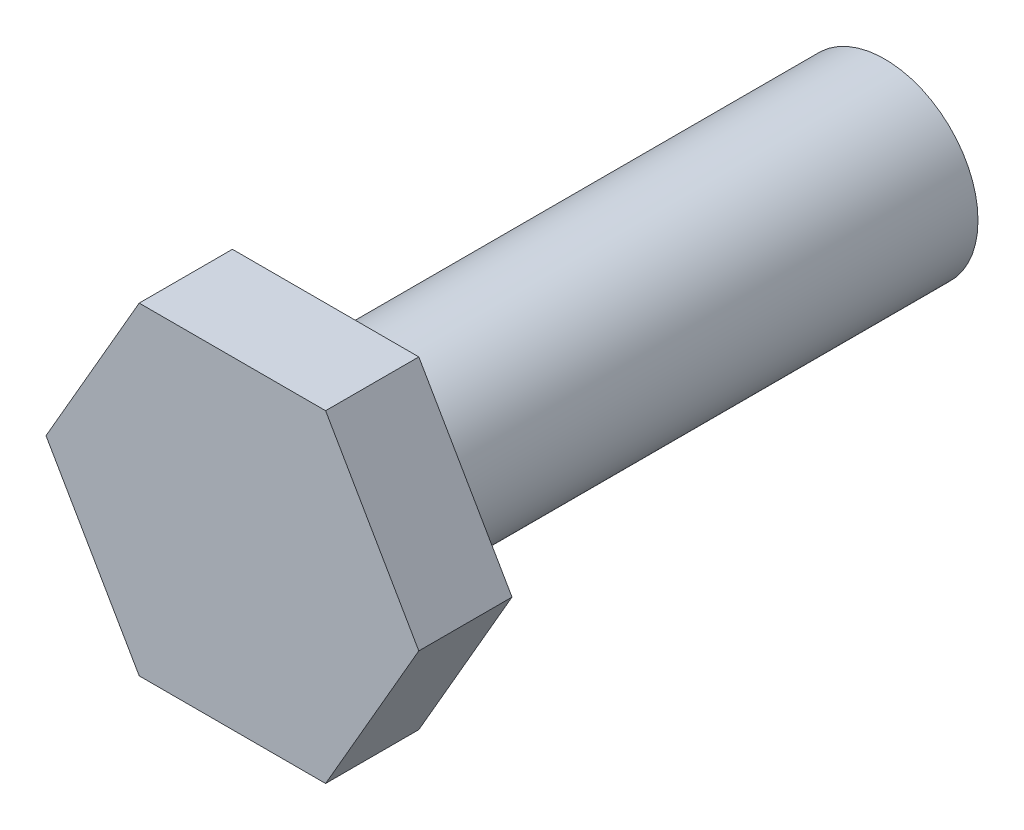
from build123d import *

# Parameters (mm, degrees)
SKETCH1_R           = 5
BOSS_EXTRUDE1_DEPTH = 30
SKETCH6_R           = 5
BOSS_EXTRUDE3_DEPTH = 5


with BuildPart() as part:
    # Sketch1 → Boss-Extrude1 (new body)
    with BuildSketch(Plane.XY):
        Circle(SKETCH1_R)
    extrude(amount=BOSS_EXTRUDE1_DEPTH)

    # Sketch6 → Boss-Extrude3 (add)
    # profile 1 of 2: a face of its own
    with BuildSketch(Plane.XY.offset(30)):
        Polygon((5, 8.660254038), (-5, 8.660254038), (-10, 0), (-5, -8.660254038), (5, -8.660254038), (10, 0), align=None)
        Circle(SKETCH6_R, mode=Mode.SUBTRACT)
    # profile 2 of 2: a face of its own
    with BuildSketch(Plane.XY.offset(30)):
        Circle(SKETCH6_R)
    extrude(amount=BOSS_EXTRUDE3_DEPTH)


solid = part.part
